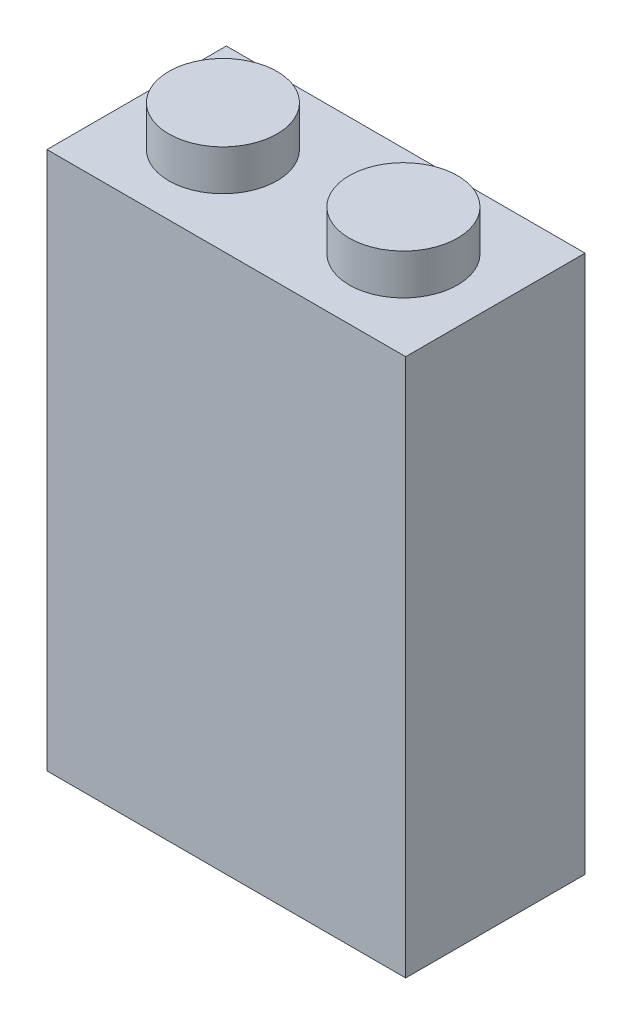
from build123d import *

# Parameters (mm, degrees)
SKETCH1_W           = 15.9
SKETCH1_H           = 23.85
BOSS_EXTRUDE1_DEPTH = 7.95
SKETCH2_R           = 2.4
BOSS_EXTRUDE2_DEPTH = 1.8
LPATTERN1_COUNT     = 2
LPATTERN1_PITCH     = 8
SHELL1_T            = -1.2


with BuildPart() as part:
    # Sketch1 → Boss-Extrude1 (new body)
    with BuildSketch(Plane.XY):
        Rectangle(SKETCH1_W, SKETCH1_H)
    extrude(amount=-BOSS_EXTRUDE1_DEPTH)

    # Sketch2 → Boss-Extrude2 (add)
    with BuildSketch(Plane(origin=(0, 11.925, 0), x_dir=(1, 0, 0), z_dir=(0, 1, 0))):
        with Locations(Location((-4.05, 3.9, 0), (0, 0, 270))):
            Circle(SKETCH2_R)
    boss_extrude2 = extrude(amount=BOSS_EXTRUDE2_DEPTH)

    # LPattern1: Boss-Extrude2 ×2
    with Locations(*[(i * LPATTERN1_PITCH, 0, 0) for i in range(1, LPATTERN1_COUNT)]):
        add(boss_extrude2)

    # Shell1
    shell1_openings = [part.faces().sort_by_distance(p)[0] for p in [
        (0, -11.925, -3.975),
    ]]
    offset(amount=SHELL1_T, openings=shell1_openings, kind=Kind.INTERSECTION)


solid = part.part
